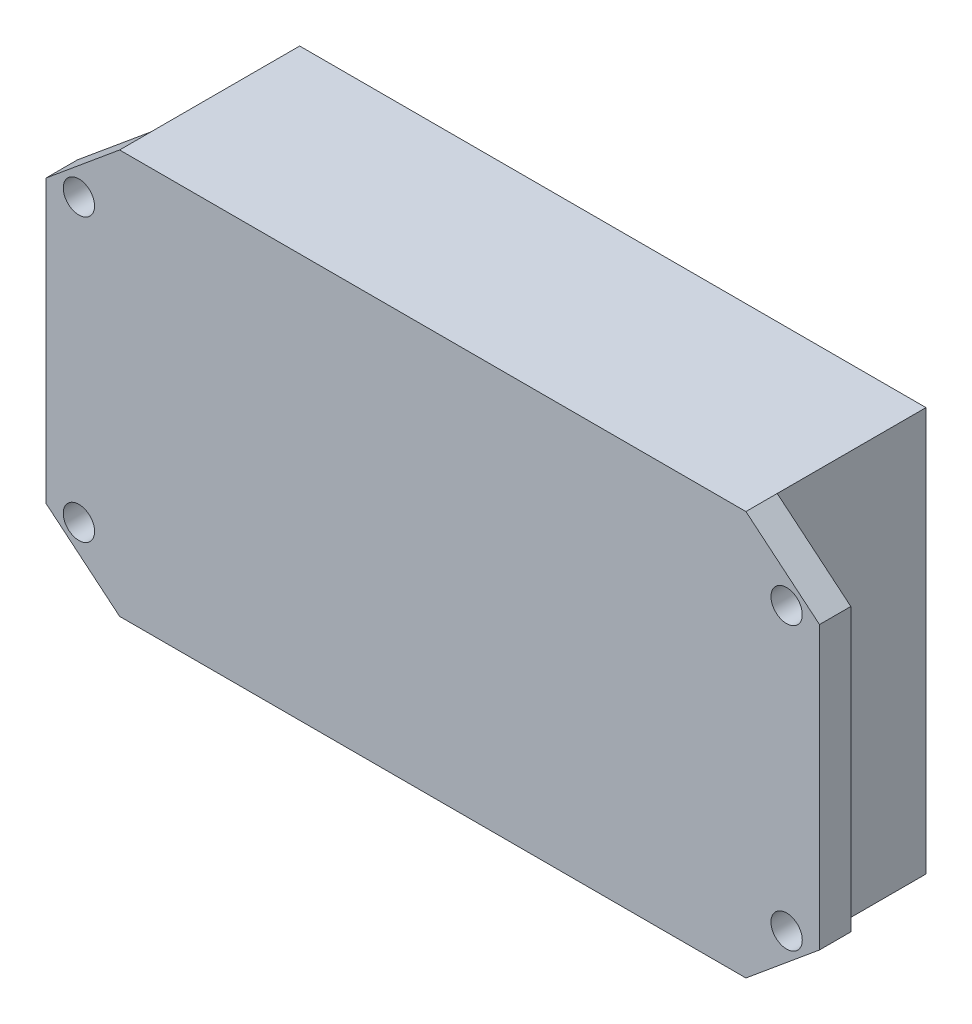
from build123d import *

# Parameters (mm, degrees)
SKETCH_1_W      = 40
SKETCH_1_H      = 25.8
EXTRUDE_1_DEPTH = 9.5
SKETCH_2_R      = 1
EXTRUDE_2_DEPTH = 2


with BuildPart() as part:
    # 草图1 → 凸台-拉伸1 (new body)
    with BuildSketch(Plane.XY):
        Rectangle(SKETCH_1_W, SKETCH_1_H)
    extrude(amount=EXTRUDE_1_DEPTH)

    # 草图2 → 凸台-拉伸2 (add)
    with BuildSketch(Plane.XY.offset(9.5)):
        Polygon((-20, 12.9), (20, 12.9), (24.7, 9), (24.7, -9), (20, -12.9), (-20, -12.9), (-24.7, -9), (-24.7, 9), align=None)
        with Locations((-22.6, 9)):
            Circle(SKETCH_2_R, mode=Mode.SUBTRACT)
        with Locations(Location((22.6, 9, 0), (0, 0, 180))):
            Circle(SKETCH_2_R, mode=Mode.SUBTRACT)
        with Locations((22.6, -9)):
            Circle(SKETCH_2_R, mode=Mode.SUBTRACT)
        with Locations(Location((-22.6, -9, 0), (0, 0, 180))):
            Circle(SKETCH_2_R, mode=Mode.SUBTRACT)
    extrude(amount=EXTRUDE_2_DEPTH)


solid = part.part
